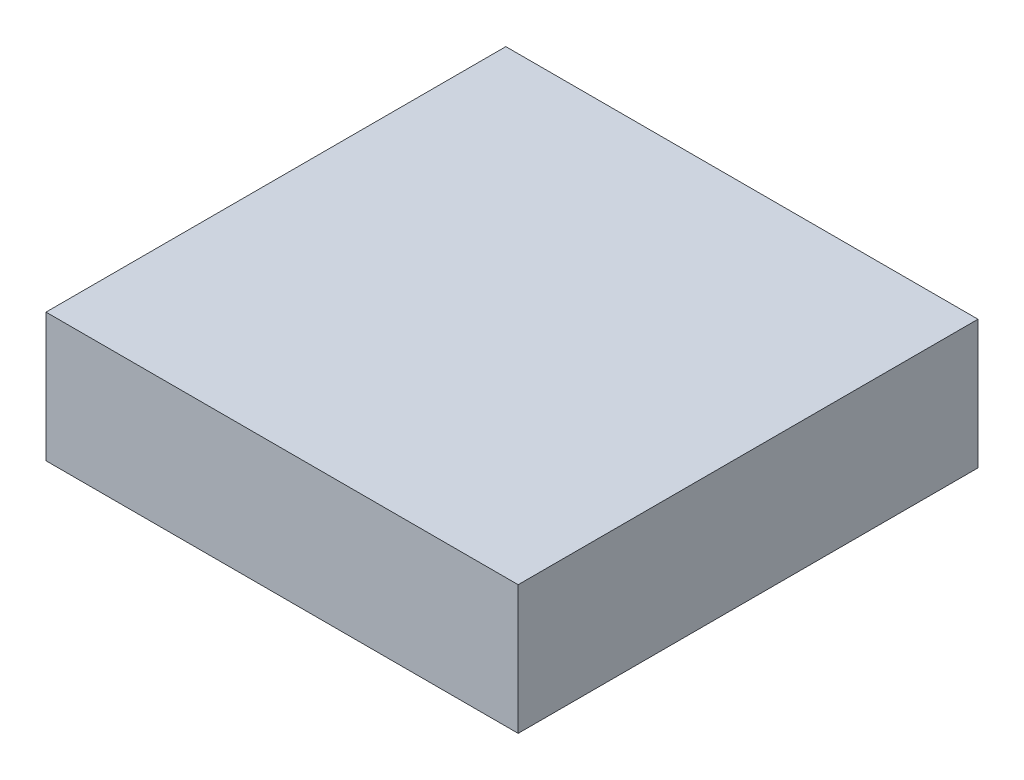
from build123d import *

# Parameters (mm, degrees)
SKETCH1_W           = 33
SKETCH1_H           = 9
BOSS_EXTRUDE1_DEPTH = 32.1390625


with BuildPart() as part:
    # Sketch1 → Boss-Extrude1 (new body)
    with BuildSketch(Plane.XY):
        with Locations((16.5, 4.5)):
            Rectangle(SKETCH1_W, SKETCH1_H)
    extrude(amount=BOSS_EXTRUDE1_DEPTH)


solid = part.part
